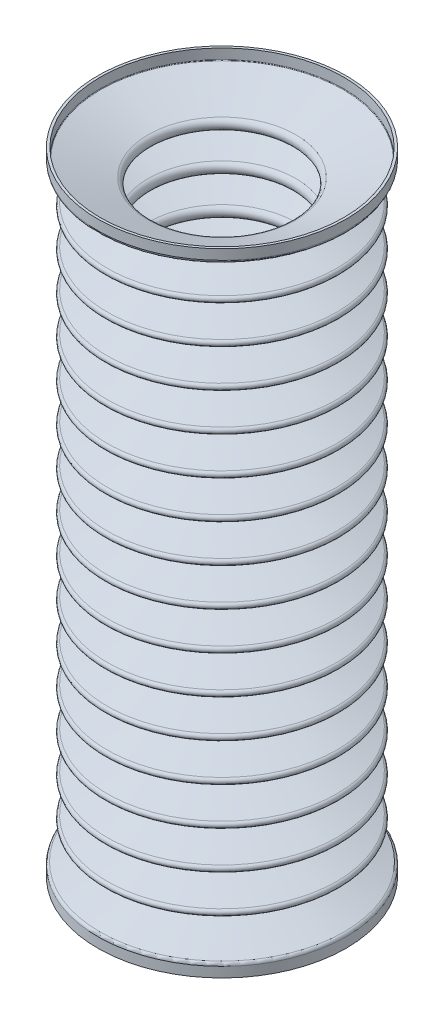
from build123d import *

# Parameters (mm, degrees)
SHELL1_T = -1.1938


with BuildPart() as part:
    # Sketch1 → Revolve2 (revolve)
    with BuildSketch(Plane.XY):
        with BuildLine():
            Line((0, 0), (0, 304.8))
            Line((0, 304.8), (59.944, 304.8))
            Line((59.944, 304.8), (59.944, 299.941640118))
            ThreePointArc((59.944, 299.941640118), (59.651638074, 299.044063572), (58.886724862, 298.490866564))
            Line((58.886724862, 298.490866564), (36.005603135, 291.129836053))
            ThreePointArc((36.005603135, 291.129836053), (34.948327998, 289.6790625), (36.005603135, 288.228288947))
            Line((36.005603135, 288.228288947), (55.434396865, 281.977898553))
            ThreePointArc((55.434396865, 281.977898553), (56.491672002, 280.527125), (55.434396865, 279.076351447))
            Line((55.434396865, 279.076351447), (36.005603135, 272.825961053))
            ThreePointArc((36.005603135, 272.825961053), (34.948327998, 271.3751875), (36.005603135, 269.924413947))
            Line((36.005603135, 269.924413947), (55.434396865, 263.674023553))
            ThreePointArc((55.434396865, 263.674023553), (56.491672002, 262.22325), (55.434396865, 260.772476447))
            Line((55.434396865, 260.772476447), (36.005603135, 254.522086053))
            ThreePointArc((36.005603135, 254.522086053), (34.948327998, 253.0713125), (36.005603135, 251.620538947))
            Line((36.005603135, 251.620538947), (55.434396865, 245.370148553))
            ThreePointArc((55.434396865, 245.370148553), (56.491672002, 243.919375), (55.434396865, 242.468601447))
            Line((55.434396865, 242.468601447), (36.005603135, 236.218211053))
            ThreePointArc((36.005603135, 236.218211053), (34.948327998, 234.7674375), (36.005603135, 233.316663947))
            Line((36.005603135, 233.316663947), (55.434396865, 227.066273553))
            ThreePointArc((55.434396865, 227.066273553), (56.491672002, 225.6155), (55.434396865, 224.164726447))
            Line((55.434396865, 224.164726447), (36.005603135, 217.914336053))
            ThreePointArc((36.005603135, 217.914336053), (34.948327998, 216.4635625), (36.005603135, 215.012788947))
            Line((36.005603135, 215.012788947), (55.434396865, 208.762398553))
            ThreePointArc((55.434396865, 208.762398553), (56.491672002, 207.311625), (55.434396865, 205.860851447))
            Line((55.434396865, 205.860851447), (36.005603135, 199.610461053))
            ThreePointArc((36.005603135, 199.610461053), (34.948327998, 198.1596875), (36.005603135, 196.708913947))
            Line((36.005603135, 196.708913947), (55.434396865, 190.458523553))
            ThreePointArc((55.434396865, 190.458523553), (56.491672002, 189.00775), (55.434396865, 187.556976447))
            Line((55.434396865, 187.556976447), (36.005603135, 181.306586053))
            ThreePointArc((36.005603135, 181.306586053), (34.948327998, 179.8558125), (36.005603135, 178.405038947))
            Line((36.005603135, 178.405038947), (55.434396865, 172.154648553))
            ThreePointArc((55.434396865, 172.154648553), (56.491672002, 170.703875), (55.434396865, 169.253101447))
            Line((55.434396865, 169.253101447), (36.005603135, 163.002711053))
            ThreePointArc((36.005603135, 163.002711053), (34.948327998, 161.5519375), (36.005603135, 160.101163947))
            Line((36.005603135, 160.101163947), (55.434396865, 153.850773553))
            ThreePointArc((55.434396865, 153.850773553), (56.491672002, 152.4), (55.434396865, 150.949226447))
            Line((55.434396865, 150.949226447), (36.005603135, 144.698836053))
            ThreePointArc((36.005603135, 144.698836053), (34.948327998, 143.2480625), (36.005603135, 141.797288947))
            Line((36.005603135, 141.797288947), (55.434396865, 135.546898553))
            ThreePointArc((55.434396865, 135.546898553), (56.491672002, 134.096125), (55.434396865, 132.645351447))
            Line((55.434396865, 132.645351447), (36.005603135, 126.394961053))
            ThreePointArc((36.005603135, 126.394961053), (34.948327998, 124.9441875), (36.005603135, 123.493413947))
            Line((36.005603135, 123.493413947), (55.434396865, 117.243023553))
            ThreePointArc((55.434396865, 117.243023553), (56.491672002, 115.79225), (55.434396865, 114.341476447))
            Line((55.434396865, 114.341476447), (36.005603135, 108.091086053))
            ThreePointArc((36.005603135, 108.091086053), (34.948327998, 106.6403125), (36.005603135, 105.189538947))
            Line((36.005603135, 105.189538947), (55.434396865, 98.939148553))
            ThreePointArc((55.434396865, 98.939148553), (56.491672002, 97.488375), (55.434396865, 96.037601447))
            Line((55.434396865, 96.037601447), (36.005603135, 89.787211053))
            ThreePointArc((36.005603135, 89.787211053), (34.948327998, 88.3364375), (36.005603135, 86.885663947))
            Line((36.005603135, 86.885663947), (55.434396865, 80.635273553))
            ThreePointArc((55.434396865, 80.635273553), (56.491672002, 79.1845), (55.434396865, 77.733726447))
            Line((55.434396865, 77.733726447), (36.005603135, 71.483336053))
            ThreePointArc((36.005603135, 71.483336053), (34.948327998, 70.0325625), (36.005603135, 68.581788947))
            Line((36.005603135, 68.581788947), (55.434396865, 62.331398553))
            ThreePointArc((55.434396865, 62.331398553), (56.491672002, 60.880625), (55.434396865, 59.429851447))
            Line((55.434396865, 59.429851447), (36.005603135, 53.179461053))
            ThreePointArc((36.005603135, 53.179461053), (34.948327998, 51.7286875), (36.005603135, 50.277913947))
            Line((36.005603135, 50.277913947), (55.434396865, 44.027523553))
            ThreePointArc((55.434396865, 44.027523553), (56.491672002, 42.57675), (55.434396865, 41.125976447))
            Line((55.434396865, 41.125976447), (36.005603135, 34.875586053))
            ThreePointArc((36.005603135, 34.875586053), (34.948327998, 33.4248125), (36.005603135, 31.974038947))
            Line((36.005603135, 31.974038947), (55.434396865, 25.723648553))
            ThreePointArc((55.434396865, 25.723648553), (56.491672002, 24.272875), (55.434396865, 22.822101447))
            Line((55.434396865, 22.822101447), (36.005603135, 16.571711053))
            ThreePointArc((36.005603135, 16.571711053), (34.948327998, 15.1209375), (36.005603135, 13.670163947))
            Line((36.005603135, 13.670163947), (58.886724862, 6.309133436))
            ThreePointArc((58.886724862, 6.309133436), (59.651638074, 5.755936428), (59.944, 4.858359882))
            Line((59.944, 4.858359882), (59.944, 0))
            Line((59.944, 0), (0, 0))
        make_face()
    revolve(axis=Axis((0, 0, 0), (0, 1, 0)))

    # Shell1
    shell1_openings = [part.faces().sort_by_distance(p)[0] for p in [
        (0, 0, 0),
        (0, 304.8, 0),
    ]]
    offset(amount=SHELL1_T, openings=shell1_openings, kind=Kind.INTERSECTION)


solid = part.part
